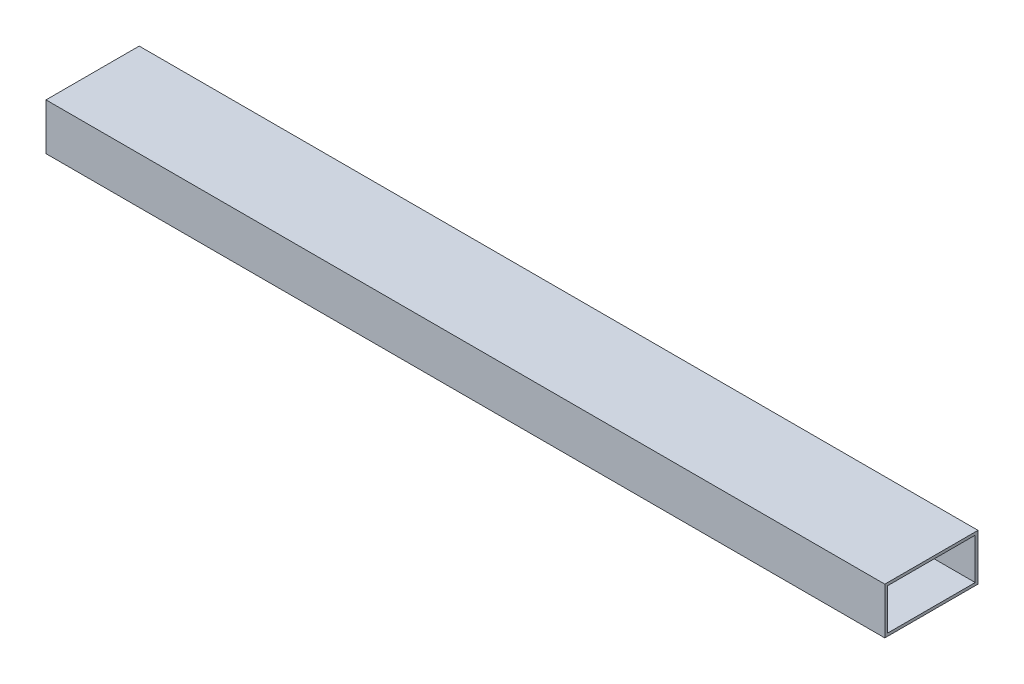
from build123d import *

# Parameters (mm, degrees)
SKETCH2_W           = 50.8
SKETCH2_H           = 25.4
SKETCH2_W_2         = 47.752
SKETCH2_H_2         = 22.352
EXTRUDE_THIN1_DEPTH = 457.2


with BuildPart() as part:
    # Sketch2 → Extrude-Thin1 (new body)
    with BuildSketch(Plane(origin=(0, 0, 0), x_dir=(0, 0, -1), z_dir=(1, 0, 0))):
        with Locations((-25.4, 12.7)):
            Rectangle(SKETCH2_W, SKETCH2_H)
        with Locations((-25.4, 12.7)):
            Rectangle(SKETCH2_W_2, SKETCH2_H_2, mode=Mode.SUBTRACT)
    extrude(amount=EXTRUDE_THIN1_DEPTH)


solid = part.part
